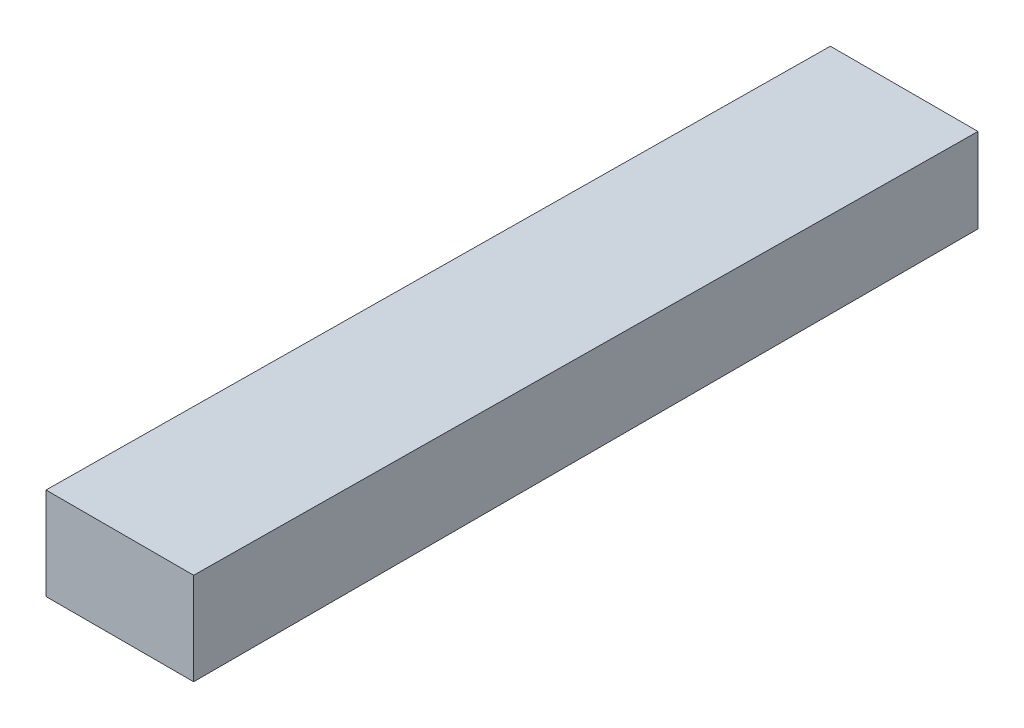
from build123d import *

# Parameters (mm, degrees)
SKETCH1_W           = 16
SKETCH1_H           = 10
BOSS_EXTRUDE1_DEPTH = 42.5
CUT_EXTRUDE2_DEPTH  = 85


with BuildPart() as part:
    # Sketch1 → Boss-Extrude1 (new, symmetric)
    with BuildSketch(Plane.XY):
        with Locations((8, 5)):
            Rectangle(SKETCH1_W, SKETCH1_H)
    extrude(amount=BOSS_EXTRUDE1_DEPTH, both=True)

    # Sketch3 → Cut-Extrude2 (cut)
    with BuildSketch(Plane.ZY):
        Polygon((-42.5, 9.15), (42.5, 10), (-42.5, 10), align=None)
    extrude(amount=-CUT_EXTRUDE2_DEPTH, mode=Mode.SUBTRACT)


solid = part.part
